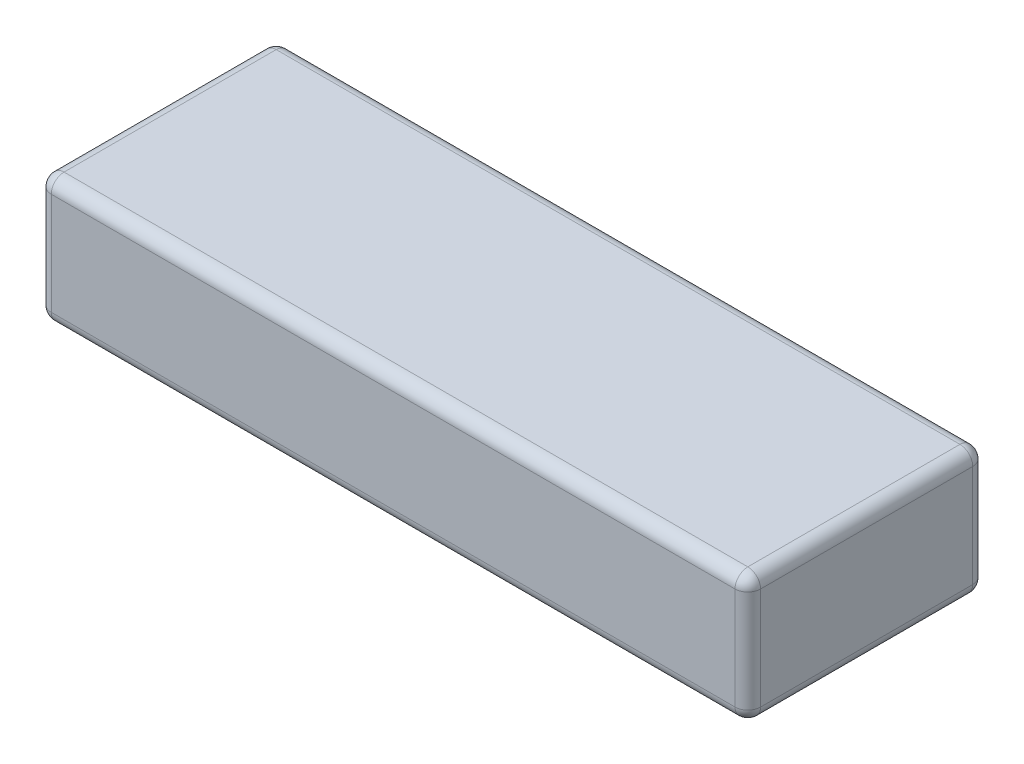
from build123d import *

# Parameters (mm, degrees)
SKETCH1_W           = 18.6
SKETCH1_H           = 10
BOSS_EXTRUDE1_DEPTH = 55.5
FILLET1_R           = 1
FILLET2_R           = 1


with BuildPart() as part:
    # Sketch1 → Boss-Extrude1 (new body)
    with BuildSketch(Plane(origin=(0, 0, 0), x_dir=(0, 0, -1), z_dir=(1, 0, 0))):
        Rectangle(SKETCH1_W, SKETCH1_H)
    extrude(amount=-BOSS_EXTRUDE1_DEPTH)

    # Fillet1
    fillet1_edges = [part.edges().sort_by_distance(p)[0] for p in [
        (-27.75, -5, -9.3),
        (-27.75, -5, 9.3),
        (-27.75, 5, 9.3),
        (-27.75, 5, -9.3),
    ]]
    fillet(fillet1_edges, radius=FILLET1_R)

    # Fillet2
    fillet2_edges = [part.edges().sort_by_distance(p)[0] for p in [
        (0, 0, -9.3),
        (-55.5, 0, -9.3),
        (0, 5, 0),
        (0, 0, 9.3),
        (0, -5, 0),
        (0, 4.707106781, 9.007106781),
        (0, -4.707106781, 9.007106781),
        (0, -4.707106781, -9.007106781),
        (0, 4.707106781, -9.007106781),
        (-55.5, 5, 0),
        (-55.5, -5, 0),
        (-55.5, 0, 9.3),
        (-55.5, 4.707106781, 9.007106781),
        (-55.5, -4.707106781, 9.007106781),
        (-55.5, -4.707106781, -9.007106781),
        (-55.5, 4.707106781, -9.007106781),
    ]]
    fillet(fillet2_edges, radius=FILLET2_R)


solid = part.part
